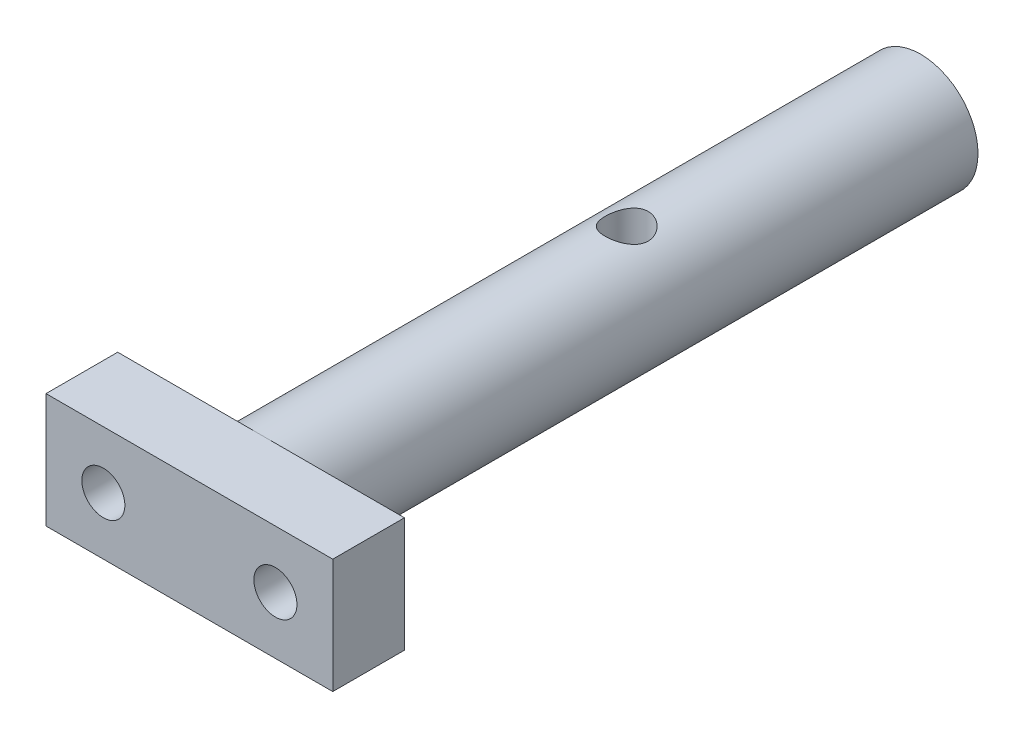
from build123d import *

# Parameters (mm, degrees)
CROQUIS1_R              = 4
SALIENTE_EXTRUIR1_DEPTH = 46
CROQUIS2_W              = 20
CROQUIS2_H              = 8
SALIENTE_EXTRUIR2_DEPTH = 5
CORTAR_EXTRUIR1_REACH   = 54.125
CROQUIS3_R              = 1.5
CROQUIS4_R              = 1.5
CORTAR_EXTRUIR2_DEPTH   = 5


with BuildPart() as part:
    # Croquis1 → Saliente-Extruir1 (new body)
    with BuildSketch(Plane(origin=(0, 0, 0), x_dir=(0, 1, 0), z_dir=(0, 0, 1))):
        with Locations(Location((0, 0, 0), (0, 0, 270))):
            Circle(CROQUIS1_R)
    extrude(amount=SALIENTE_EXTRUIR1_DEPTH)

    # Croquis2 → Saliente-Extruir2 (add)
    with BuildSketch(Plane.XY.offset(46)):
        Rectangle(CROQUIS2_W, CROQUIS2_H)
    extrude(amount=SALIENTE_EXTRUIR2_DEPTH)

    # Croquis3 → Cortar-Extruir1 (cut, up to next)
    with BuildSketch(Plane.XY.offset(51), mode=Mode.PRIVATE) as cortar_extruir1_sk1:
        with Locations((6, 0)):
            Circle(CROQUIS3_R)
    cortar_extruir1_tool1 = extrude(cortar_extruir1_sk1.sketch, amount=-CORTAR_EXTRUIR1_REACH, mode=Mode.PRIVATE) & part.part
    # Croquis3 → Cortar-Extruir1 (cut, up to next)
    with BuildSketch(Plane.XY.offset(51), mode=Mode.PRIVATE) as cortar_extruir1_sk2:
        with Locations(Location((-6, 0, 0), (0, 0, 180))):
            Circle(CROQUIS3_R)
    cortar_extruir1_tool2 = extrude(cortar_extruir1_sk2.sketch, amount=-CORTAR_EXTRUIR1_REACH, mode=Mode.PRIVATE) & part.part
    add(cortar_extruir1_tool1.solids().sort_by_distance((6, 0, 51))[0], mode=Mode.SUBTRACT)
    add(cortar_extruir1_tool2.solids().sort_by_distance((-6, 0, 51))[0], mode=Mode.SUBTRACT)

    # Croquis4 → Cortar-Extruir2 (cut, symmetric)
    with BuildSketch(Plane(origin=(0, 0, 0), x_dir=(-1, 0, 0), z_dir=(0, 1, 0))):
        with Locations(Location((0, 20.5, 0), (0, 0, 90))):
            Circle(CROQUIS4_R)
    extrude(amount=CORTAR_EXTRUIR2_DEPTH, both=True, mode=Mode.SUBTRACT)


solid = part.part
